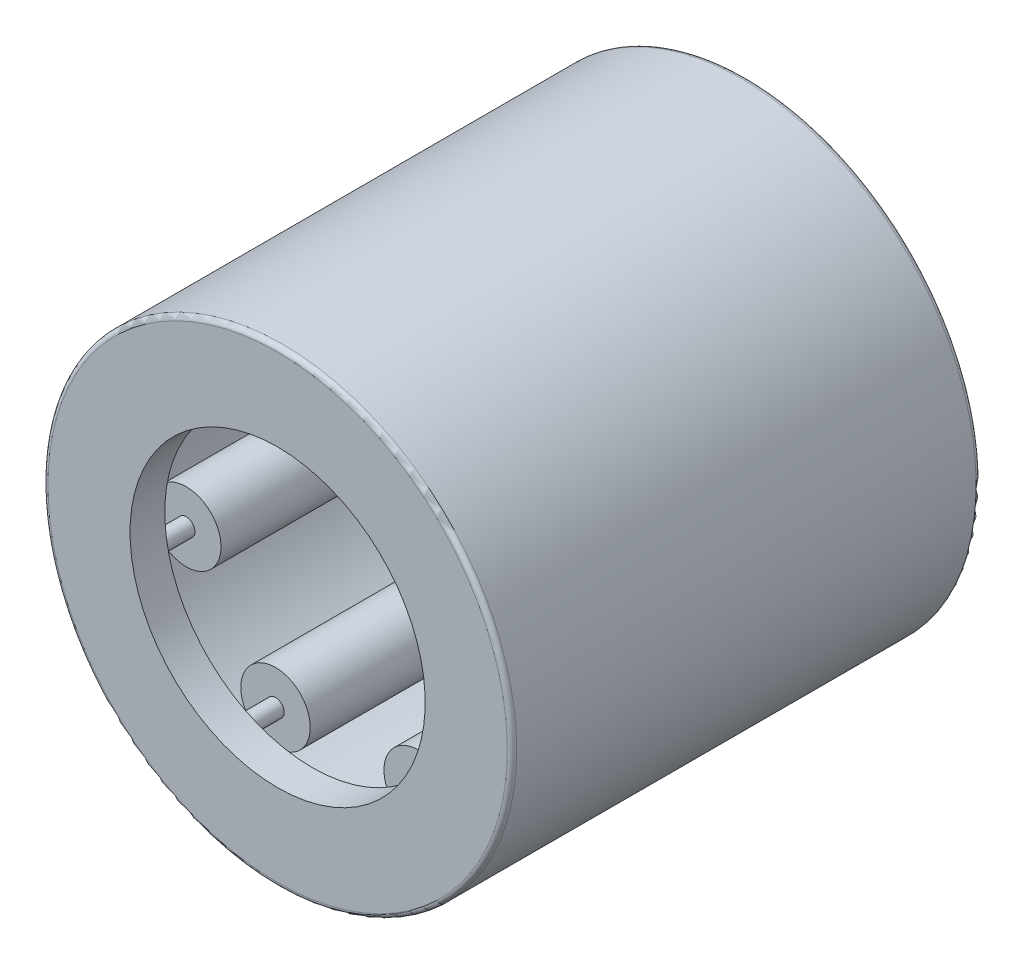
from build123d import *

# Parameters (mm, degrees)
SKETCH2_W         = 6.333333334
SKETCH2_H         = 0.5
SKETCH3_W         = 7.666666666
SKETCH3_H         = 0.166666666
CIRPATTERN1_COUNT = 7
CIRPATTERN1_ANGLE = 308.571428571
FILLET1_R         = 0.09


with BuildPart() as part:
    # Sketch7 → Revolve1 (revolve)
    with BuildSketch(Plane(origin=(0, 0, 0), x_dir=(0, 0, -1), z_dir=(1, 0, 0))):
        Polygon((-4.5, 4.5), (-4.5, 2.833333333), (-3.833333333, 2.833333333), (-3.833333333, 3.833333333), (3.833333333, 3.833333333), (3.833333333, 2.833333333), (4.5, 2.833333333), (4.5, 4.5), align=None)
    revolve(axis=Axis((0, 0, 4.5), (0, 0, -1)))

    # Fillet1
    fillet1_edges = [part.edges().sort_by_distance(p)[0] for p in [
        (0, -4.5, -4.5),
        (0, -4.5, 4.5),
    ]]
    fillet(fillet1_edges, radius=FILLET1_R)


with BuildPart() as body_2:
    # Sketch2 → Revolve2 (revolve)
    with BuildSketch(Plane(origin=(0, 0, 0), x_dir=(0, 0, -1), z_dir=(1, 0, 0))):
        with Locations((0, 3.583333333)):
            Rectangle(SKETCH2_W, SKETCH2_H)
    revolve(axis=Axis((0, 3.166666667, 3.166666667), (0, 0, -1)))


with BuildPart() as body_3:
    # Sketch3 → Revolve3 (revolve)
    with BuildSketch(Plane(origin=(0, 0, 0), x_dir=(0, 0, -1), z_dir=(1, 0, 0))):
        with Locations((0, 3.25)):
            Rectangle(SKETCH3_W, SKETCH3_H)
    revolve(axis=Axis((0, 3.166666667, 3.833333333), (0, 0, -1)))


with BuildPart() as cirpattern1_1:
    # CirPattern1: pattern copy
    add(body_2.part.rotate(Axis((0, 0, 4.5), (0, 0, -1)), 1 * CIRPATTERN1_ANGLE / (CIRPATTERN1_COUNT - 1)))


with BuildPart() as cirpattern1_2:
    # CirPattern1: pattern copy
    add(body_2.part.rotate(Axis((0, 0, 4.5), (0, 0, -1)), 2 * CIRPATTERN1_ANGLE / (CIRPATTERN1_COUNT - 1)))


with BuildPart() as cirpattern1_3:
    # CirPattern1: pattern copy
    add(body_2.part.rotate(Axis((0, 0, 4.5), (0, 0, -1)), 3 * CIRPATTERN1_ANGLE / (CIRPATTERN1_COUNT - 1)))


with BuildPart() as cirpattern1_4:
    # CirPattern1: pattern copy
    add(body_2.part.rotate(Axis((0, 0, 4.5), (0, 0, -1)), 4 * CIRPATTERN1_ANGLE / (CIRPATTERN1_COUNT - 1)))


with BuildPart() as cirpattern1_5:
    # CirPattern1: pattern copy
    add(body_2.part.rotate(Axis((0, 0, 4.5), (0, 0, -1)), 5 * CIRPATTERN1_ANGLE / (CIRPATTERN1_COUNT - 1)))


with BuildPart() as cirpattern1_6:
    # CirPattern1: pattern copy
    add(body_2.part.rotate(Axis((0, 0, 4.5), (0, 0, -1)), 6 * CIRPATTERN1_ANGLE / (CIRPATTERN1_COUNT - 1)))


with BuildPart() as cirpattern1_7:
    # CirPattern1: pattern copy
    add(body_3.part.rotate(Axis((0, 0, 4.5), (0, 0, -1)), 1 * CIRPATTERN1_ANGLE / (CIRPATTERN1_COUNT - 1)))


with BuildPart() as cirpattern1_8:
    # CirPattern1: pattern copy
    add(body_3.part.rotate(Axis((0, 0, 4.5), (0, 0, -1)), 2 * CIRPATTERN1_ANGLE / (CIRPATTERN1_COUNT - 1)))


with BuildPart() as cirpattern1_9:
    # CirPattern1: pattern copy
    add(body_3.part.rotate(Axis((0, 0, 4.5), (0, 0, -1)), 3 * CIRPATTERN1_ANGLE / (CIRPATTERN1_COUNT - 1)))


with BuildPart() as cirpattern1_10:
    # CirPattern1: pattern copy
    add(body_3.part.rotate(Axis((0, 0, 4.5), (0, 0, -1)), 4 * CIRPATTERN1_ANGLE / (CIRPATTERN1_COUNT - 1)))


with BuildPart() as cirpattern1_11:
    # CirPattern1: pattern copy
    add(body_3.part.rotate(Axis((0, 0, 4.5), (0, 0, -1)), 5 * CIRPATTERN1_ANGLE / (CIRPATTERN1_COUNT - 1)))


with BuildPart() as cirpattern1_12:
    # CirPattern1: pattern copy
    add(body_3.part.rotate(Axis((0, 0, 4.5), (0, 0, -1)), 6 * CIRPATTERN1_ANGLE / (CIRPATTERN1_COUNT - 1)))


solid = Compound([part.part, body_2.part, body_3.part, cirpattern1_1.part, cirpattern1_2.part, cirpattern1_3.part, cirpattern1_4.part, cirpattern1_5.part, cirpattern1_6.part, cirpattern1_7.part, cirpattern1_8.part, cirpattern1_9.part, cirpattern1_10.part, cirpattern1_11.part, cirpattern1_12.part])
